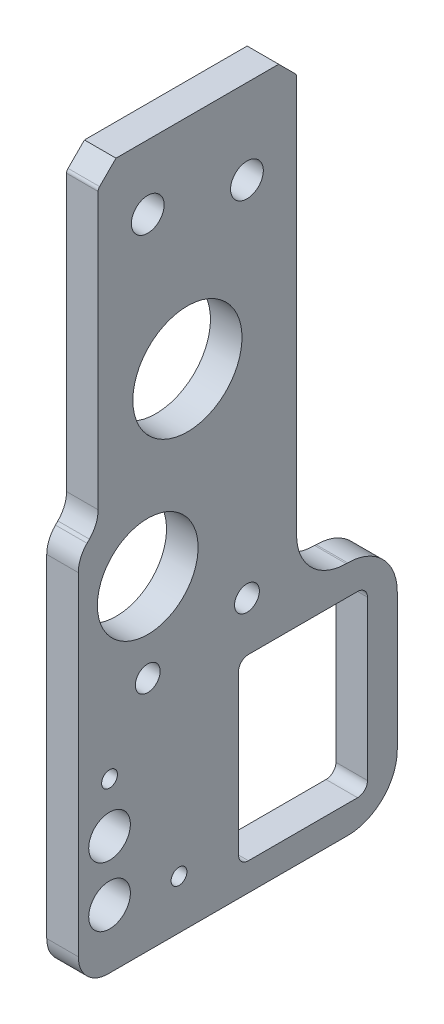
from build123d import *

# Parameters (mm, degrees)
SKETCH1_R             = 5.075
SKETCH1_R_2           = 1.65
SKETCH1_R_3           = 2.1
SKETCH1_R_4           = 0.8
SKETCH1_W             = 13
SKETCH1_H             = 18
BOSS_EXTRUDE1_DEPTH   = 3.18
SKETCH3_R             = 5.5
CUT_EXTRUDE4_DEPTH    = 78.831812262
FILLET2_R             = 3
CHAMFER2_SIZE         = 1.8
FILLET4_R             = 0.5
M2_TAPPED_HOLE1_D     = 1.6
FILLET9_R             = 1
FILLET11_R            = 5
M3X0_5_TAPPED_HOLE1_D = 2.5


with BuildPart() as part:
    # Sketch1 → Boss-Extrude1 (new body)
    with BuildSketch(Plane(origin=(0, 0, 0), x_dir=(0, 0, -1), z_dir=(1, 0, 0))):
        Polygon((0, 0), (0, 37.775), (2, 39.775), (2, 70.81), (22, 70.81), (22, 23.81), (32.15, 23.81), (32.15, 0), align=None)
        with Locations(Location((7, 32.7, 0), (0, 0, 180))):
            Circle(SKETCH1_R, mode=Mode.SUBTRACT)
        with Locations(Location((7, 64.31, 0), (0, 0, 180))):
            Circle(SKETCH1_R_2, mode=Mode.SUBTRACT)
        with Locations(Location((17, 62.31, 0), (0, 0, 180))):
            Circle(SKETCH1_R_2, mode=Mode.SUBTRACT)
        with Locations(Location((3.15, 5.95, 0), (0, 0, 180))):
            Circle(SKETCH1_R_3, mode=Mode.SUBTRACT)
        with Locations(Location((3.15, 11.95, 0), (0, 0, 180))):
            Circle(SKETCH1_R_3, mode=Mode.SUBTRACT)
        with Locations(Location((10.15, 4.95, 0), (0, 0, 180))):
            Circle(SKETCH1_R_4, mode=Mode.SUBTRACT)
        with Locations(Location((3.15, 16.95, 0), (0, 0, 180))):
            Circle(SKETCH1_R_4, mode=Mode.SUBTRACT)
        with Locations((22.65, 11.81)):
            Rectangle(SKETCH1_W, SKETCH1_H, mode=Mode.SUBTRACT)
    extrude(amount=BOSS_EXTRUDE1_DEPTH)

    # Sketch3 → Cut-Extrude4 (cut, through all)
    with BuildSketch(Plane.ZY):
        with Locations((-11, 48.810865899)):
            Circle(SKETCH3_R)
    extrude(amount=-CUT_EXTRUDE4_DEPTH, mode=Mode.SUBTRACT)

    # Fillet2
    fillet2_edges = [part.edges().sort_by_distance(p)[0] for p in [
        (1.59, 0, 0),
        (1.59, 37.775, 0),
        (1.59, 39.775, -2),
    ]]
    fillet(fillet2_edges, radius=FILLET2_R)

    # Chamfer2
    chamfer2_edges = [part.edges().sort_by_distance(p)[0] for p in [
        (1.59, 70.81, -2),
        (1.59, 70.81, -22),
    ]]
    chamfer(chamfer2_edges, length=CHAMFER2_SIZE)

    # Fillet4
    fillet4_edges = [part.edges().sort_by_distance(p)[0] for p in [
        (1.59, 69.01, -22),
        (1.59, 69.01, -2),
    ]]
    fillet(fillet4_edges, radius=FILLET4_R)

    # M2 Tapped Hole1 (through all)
    with Locations(Plane(origin=(0, 16.95, -3.15), x_dir=(0, 0, -1), z_dir=(-1, 0, 0))):
        with Locations((0, 0), (7, 12)):
            Hole(M2_TAPPED_HOLE1_D / 2)

    # Fillet9
    fillet9_edges = [part.edges().sort_by_distance(p)[0] for p in [
        (1.59, 20.81, -16.15),
        (1.59, 2.81, -16.15),
        (1.59, 2.81, -29.15),
        (1.59, 20.81, -29.15),
    ]]
    fillet(fillet9_edges, radius=FILLET9_R)

    # Fillet11
    fillet11_edges = [part.edges().sort_by_distance(p)[0] for p in [
        (1.59, 23.81, -32.15),
        (1.59, 0, -32.15),
        (1.59, 23.81, -22),
    ]]
    fillet(fillet11_edges, radius=FILLET11_R)

    # M3x0.5 Tapped Hole1 (through all)
    with Locations(Plane(origin=(3.18, 0, 0), x_dir=(0, 0, -1), z_dir=(1, 0, 0))):
        with Locations((7, 23.81), (17, 25.81)):
            Hole(M3X0_5_TAPPED_HOLE1_D / 2)


solid = part.part
